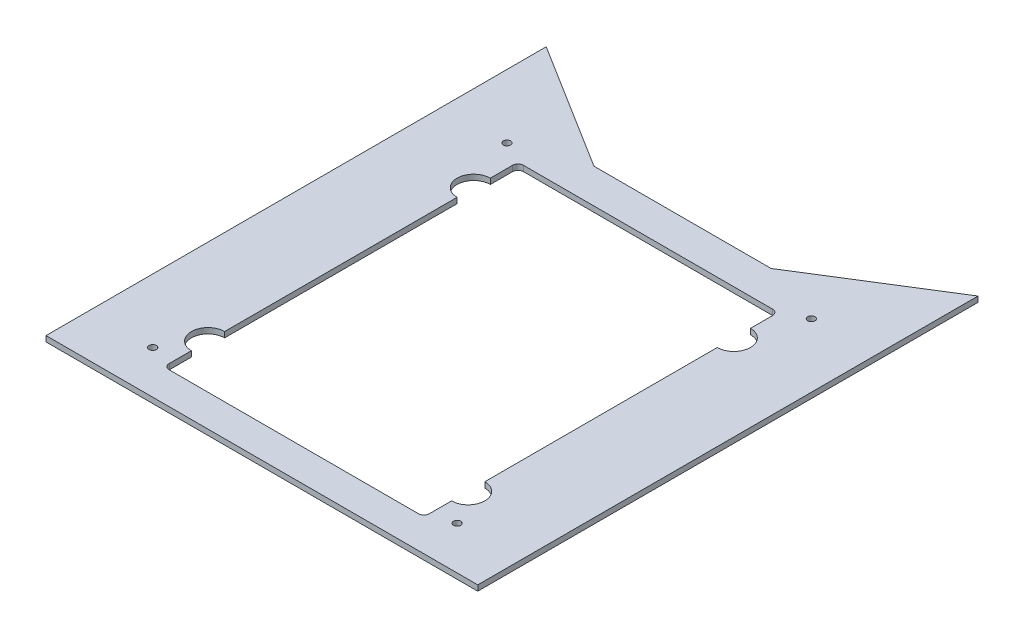
from build123d import *

# Parameters (mm, degrees)
SKETCH1_W               = 63.5
SKETCH1_H               = 190.5
BOSS_EXTRUDE1_DEPTH     = 3.175
SKETCH3_R               = 2.0828
CUT_EXTRUDE2_DEPTH      = 526.850378691
SKETCH4_R               = 2.0828
CUT_EXTRUDE4_DEPTH      = 526.850378691
FILLET2_R               = 3.175
CUT_EXTRUDE5_DEPTH      = 526.850378691
CUT_EXTRUDE5_DEPTH_BACK = 526.850378691
SKETCH5_W               = 142.875
SKETCH5_H               = 355.6


with BuildPart() as part:
    # Sketch1 → Boss-Extrude1 (new body)
    with BuildSketch(Plane(origin=(0, 0, 0), x_dir=(1, 0, 0), z_dir=(0, 1, 0))):
        Polygon((-242.686835374, -133.432512515), (-242.686835374, -385.491221995), (-242.686835374, -387.371651362), (-191.886835374, -438.171651362), (239.913164626, -438.171651362), (290.713164626, -387.371651362), (290.713164626, -133.371651362), (176.413164626, -82.571651362), (176.413164626, -133.371651362), (74.813164626, -196.871651362), (-26.786835374, -196.871651362), (-128.386835374, -133.371651362), (-128.386835374, -82.571651362), (-242.686835374, -133.371651362), align=None)
        with Locations((233.563164626, -243.80020948)):
            Rectangle(SKETCH1_W, SKETCH1_H, mode=Mode.SUBTRACT)
        with Locations((-185.536835374, -243.80020948)):
            Rectangle(SKETCH1_W, SKETCH1_H, mode=Mode.SUBTRACT)
    extrude(amount=BOSS_EXTRUDE1_DEPTH)

    # Sketch3 → Cut-Extrude2 (cut, through all)
    with BuildSketch(Plane(origin=(0, 0, 0), x_dir=(1, 0, 0), z_dir=(0, 1, 0))):
        with Locations(Location((-114.278235374, -270.125471314, 0), (0, 0, 270))):
            Circle(SKETCH3_R)
        with Locations(Location((-143.449035374, -284.13540948, 0), (0, 0, 270))):
            Circle(SKETCH3_R)
        with Locations(Location((-114.278235374, -217.474947647, 0), (0, 0, 270))):
            Circle(SKETCH3_R)
        with Locations(Location((-143.449035374, -203.46500948, 0), (0, 0, 270))):
            Circle(SKETCH3_R)
        with Locations(Location((191.475364626, -284.13540948, 0), (0, 0, 270))):
            Circle(SKETCH3_R)
        with Locations(Location((162.304564626, -270.125471314, 0), (0, 0, 270))):
            Circle(SKETCH3_R)
        with Locations(Location((162.304564626, -217.474947647, 0), (0, 0, 270))):
            Circle(SKETCH3_R)
        with Locations(Location((191.475364626, -203.46500948, 0), (0, 0, 270))):
            Circle(SKETCH3_R)
    extrude(amount=CUT_EXTRUDE2_DEPTH, mode=Mode.SUBTRACT)

    # Sketch4 → Cut-Extrude4 (cut, through all)
    with BuildSketch(Plane(origin=(0, 0, 0), x_dir=(1, 0, 0), z_dir=(0, 1, 0))):
        with Locations(Location((111.325664626, -210.298576853, 0), (0, 0, 270))):
            Circle(SKETCH4_R)
        with Locations(Location((111.325664626, -413.498576853, 0), (0, 0, 270))):
            Circle(SKETCH4_R)
        with Locations(Location((-63.299335374, -413.498576853, 0), (0, 0, 90))):
            Circle(SKETCH4_R)
        with Locations(Location((-63.299335374, -210.298576853, 0), (0, 0, 90))):
            Circle(SKETCH4_R)
        with BuildLine():
            Line((-50.599335374, -216.648576853), (98.625664626, -216.648576853))
            Line((98.625664626, -216.648576853), (98.625664626, -232.523576853))
            ThreePointArc((98.625664626, -232.523576853), (108.150664626, -242.048576853), (98.625664626, -251.573576853))
            Line((98.625664626, -251.573576853), (98.625664626, -384.923576853))
            ThreePointArc((98.625664626, -384.923576853), (108.150664626, -394.448576853), (98.625664626, -403.973576853))
            Line((98.625664626, -403.973576853), (98.625664626, -419.848576853))
            Line((98.625664626, -419.848576853), (-50.599335374, -419.848576853))
            Line((-50.599335374, -419.848576853), (-50.599335374, -403.973576853))
            ThreePointArc((-50.599335374, -403.973576853), (-60.124335374, -394.448576853), (-50.599335374, -384.923576853))
            Line((-50.599335374, -384.923576853), (-50.599335374, -251.573576853))
            ThreePointArc((-50.599335374, -251.573576853), (-60.124335374, -242.048576853), (-50.599335374, -232.523576853))
            Line((-50.599335374, -232.523576853), (-50.599335374, -216.648576853))
        make_face()
    extrude(amount=CUT_EXTRUDE4_DEPTH, mode=Mode.SUBTRACT)

    # Fillet2
    fillet2_edges = [part.edges().sort_by_distance(p)[0] for p in [
        (98.625664626, 1.5875, 419.848576853),
        (98.625664626, 1.5875, 216.648576853),
        (-50.599335374, 1.5875, 216.648576853),
        (-50.599335374, 1.5875, 419.848576853),
    ]]
    fillet(fillet2_edges, radius=FILLET2_R)

    # Sketch5 → Cut-Extrude5 (cut, two sides: drawn at the far end of the back side and taken through both)
    with BuildSketch(Plane(origin=(0, 3.175, 0), x_dir=(1, 0, 0), z_dir=(0, 1, 0)).offset(-CUT_EXTRUDE5_DEPTH_BACK)):
        with Locations((-171.249335374, -260.371651362)):
            Rectangle(SKETCH5_W, SKETCH5_H)
        with Locations((219.275664626, -260.371651362)):
            Rectangle(SKETCH5_W, SKETCH5_H)
    extrude(amount=CUT_EXTRUDE5_DEPTH + CUT_EXTRUDE5_DEPTH_BACK, mode=Mode.SUBTRACT)


solid = part.part
